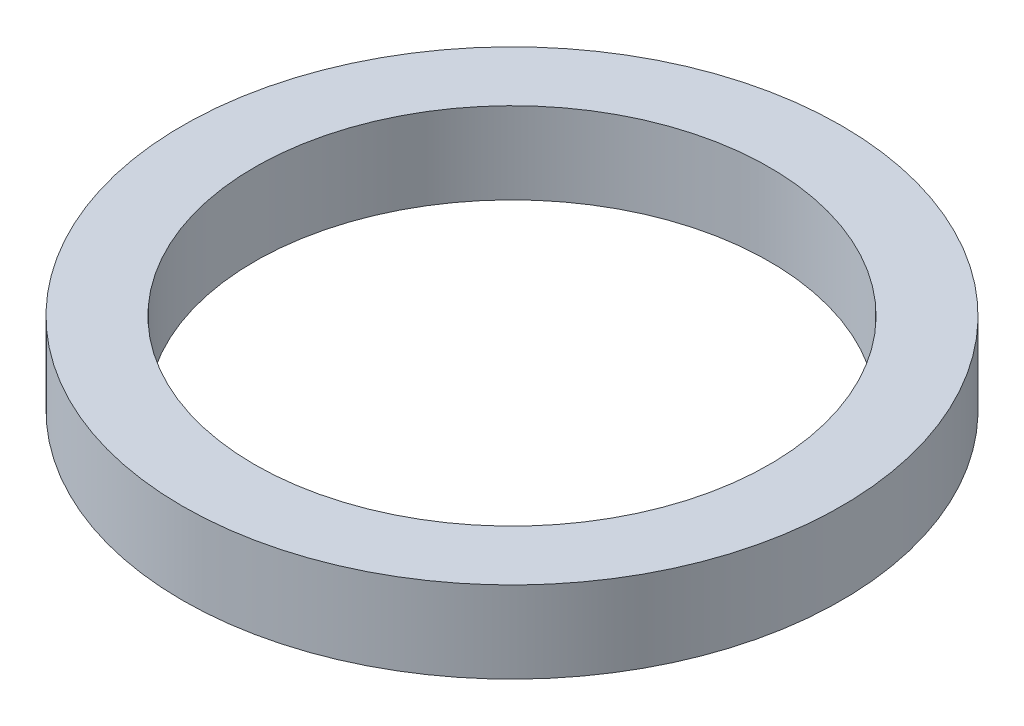
from build123d import *

# Parameters (mm, degrees)
SKETCH2_R           = 16
SKETCH2_R_2         = 12.5
BOSS_EXTRUDE1_DEPTH = 3.96


with BuildPart() as part:
    # Sketch2 → Boss-Extrude1 (new body)
    with BuildSketch(Plane(origin=(0, 0, 0), x_dir=(1, 0, 0), z_dir=(0, 1, 0))):
        with Locations(Location((0, 0, 0), (0, 0, 270))):
            Circle(SKETCH2_R)
        with Locations(Location((0, 0, 0), (0, 0, 270))):
            Circle(SKETCH2_R_2, mode=Mode.SUBTRACT)
    extrude(amount=BOSS_EXTRUDE1_DEPTH)


solid = part.part
